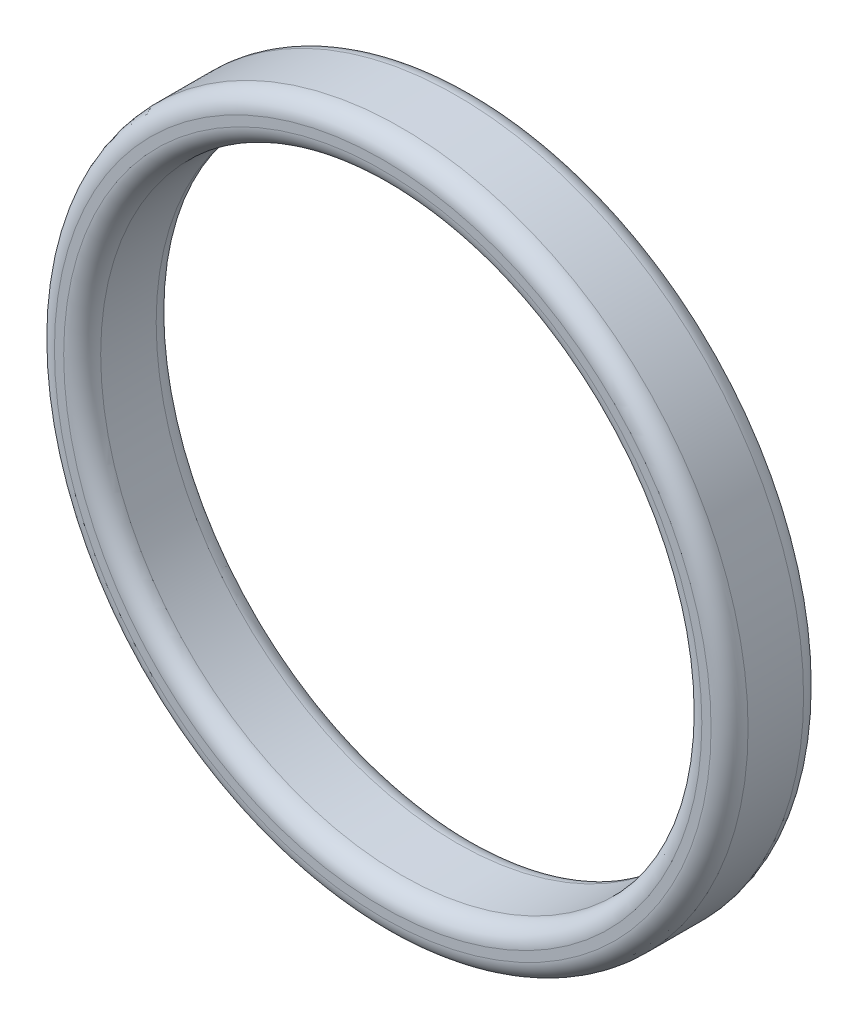
from build123d import *

# Parameters (mm, degrees)
CROQUIS1_R            = 0.15
CROQUIS1_R_2          = 0.13
EXTRUIR_L_MINA1_DEPTH = 0.02
REDONDEO1_R           = 0.008


with BuildPart() as part:
    # Croquis1 → Extruir-Lámina1 (new, symmetric)
    with BuildSketch(Plane.XY):
        Circle(CROQUIS1_R)
        Circle(CROQUIS1_R_2, mode=Mode.SUBTRACT)
    extrude(amount=EXTRUIR_L_MINA1_DEPTH, both=True)

    # Redondeo1
    redondeo1_edges = [part.edges().sort_by_distance(p)[0] for p in [
        (-0.15, 0, -0.02),
        (-0.13, 0, -0.02),
        (-0.15, 0, 0.02),
        (-0.13, 0, 0.02),
    ]]
    fillet(redondeo1_edges, radius=REDONDEO1_R)


solid = part.part
